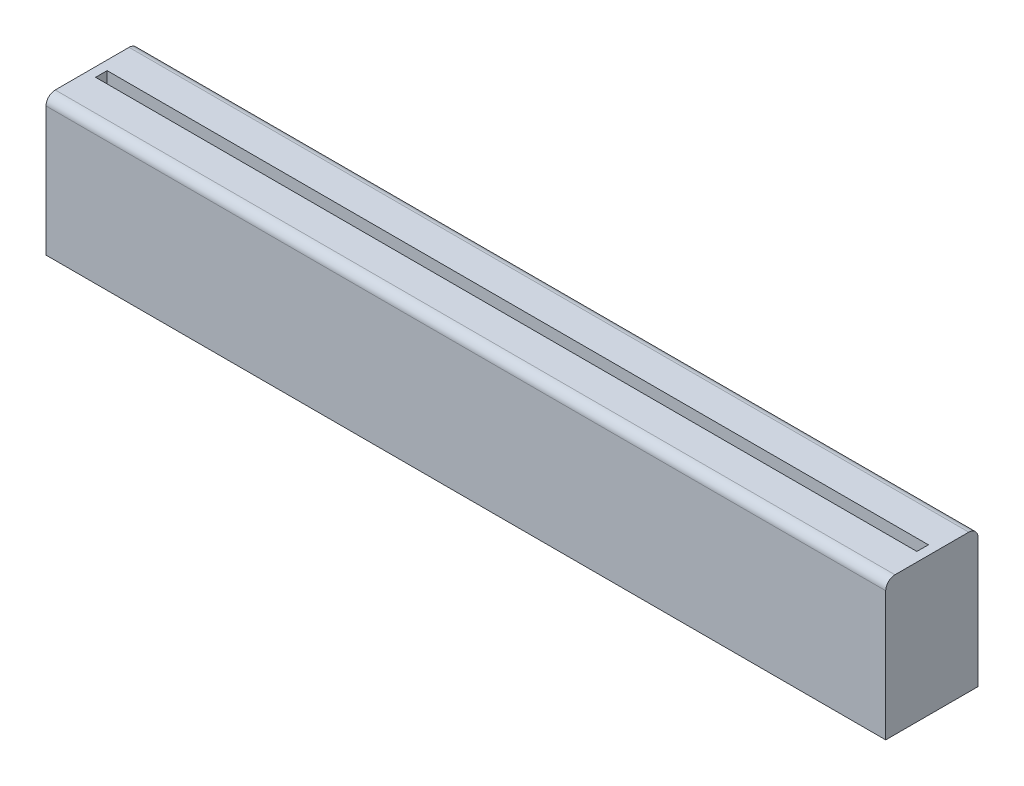
from build123d import *

# Parameters (mm, degrees)
BOSS_EXTRUDE1_DEPTH = 114.3
BOSS_EXTRUDE2_START = 114.3
BOSS_EXTRUDE2_DEPTH = 1.27
SKETCH4_W           = 12.7
SKETCH4_H           = 5.08
BOSS_EXTRUDE4_DEPTH = 1.27


with BuildPart() as part:
    # Sketch1 → Boss-Extrude1 (new, symmetric)
    with BuildSketch(Plane(origin=(0, 0, 0), x_dir=(0, 0, -1), z_dir=(1, 0, 0))):
        with BuildLine():
            Line((12.7, 0), (-12.7, 0))
            Line((-12.7, 0), (-12.7, 35.56))
            ThreePointArc((-12.7, 35.56), (-11.956051224, 37.356051224), (-10.16, 38.1))
            Line((-10.16, 38.1), (-1.5875, 38.1))
            Line((-1.5875, 38.1), (-1.5875, 7.62))
            Line((-1.5875, 7.62), (-6.35, 7.62))
            Line((-6.35, 7.62), (-6.35, 2.54))
            Line((-6.35, 2.54), (6.35, 2.54))
            Line((6.35, 2.54), (6.35, 7.62))
            Line((6.35, 7.62), (1.5875, 7.62))
            Line((1.5875, 7.62), (1.5875, 38.1))
            Line((1.5875, 38.1), (10.16, 38.1))
            ThreePointArc((10.16, 38.1), (11.956051224, 37.356051224), (12.7, 35.56))
            Line((12.7, 35.56), (12.7, 0))
        make_face()
        Polygon((10.16, 35.56), (4.1275, 35.56), (4.1275, 10.16), (8.89, 10.16), (8.89, 2.54), (10.16, 2.54), align=None, mode=Mode.SUBTRACT)
        Polygon((-4.1275, 10.16), (-8.89, 10.16), (-8.89, 2.54), (-10.16, 2.54), (-10.16, 35.56), (-4.1275, 35.56), align=None, mode=Mode.SUBTRACT)
    extrude(amount=BOSS_EXTRUDE1_DEPTH, both=True)

    # Sketch2 → Boss-Extrude2 (add, symmetric)
    with BuildSketch(Plane(origin=(0, 0, 0), x_dir=(0, 0, -1), z_dir=(1, 0, 0)).offset(BOSS_EXTRUDE2_START)):
        with BuildLine():
            Line((-12.7, 0), (12.7, 0))
            Line((12.7, 0), (12.7, 35.56))
            ThreePointArc((12.7, 35.56), (11.956051224, 37.356051224), (10.16, 38.1))
            Line((10.16, 38.1), (-10.16, 38.1))
            ThreePointArc((-10.16, 38.1), (-11.956051224, 37.356051224), (-12.7, 35.56))
            Line((-12.7, 35.56), (-12.7, 0))
        make_face()
    extrude(amount=BOSS_EXTRUDE2_DEPTH, both=True)

    # Sketch4 → Boss-Extrude4 (add, symmetric)
    with BuildSketch(Plane.ZY.offset(114.3)):
        with BuildLine():
            Line((-12.7, 0), (12.7, 0))
            Line((12.7, 0), (12.7, 35.56))
            ThreePointArc((12.7, 35.56), (11.956051224, 37.356051224), (10.16, 38.1))
            Line((10.16, 38.1), (-10.16, 38.1))
            ThreePointArc((-10.16, 38.1), (-11.956051224, 37.356051224), (-12.7, 35.56))
            Line((-12.7, 35.56), (-12.7, 0))
        make_face()
        with Locations((0, 5.08)):
            Rectangle(SKETCH4_W, SKETCH4_H, mode=Mode.SUBTRACT)
    extrude(amount=BOSS_EXTRUDE4_DEPTH, both=True)


solid = part.part
